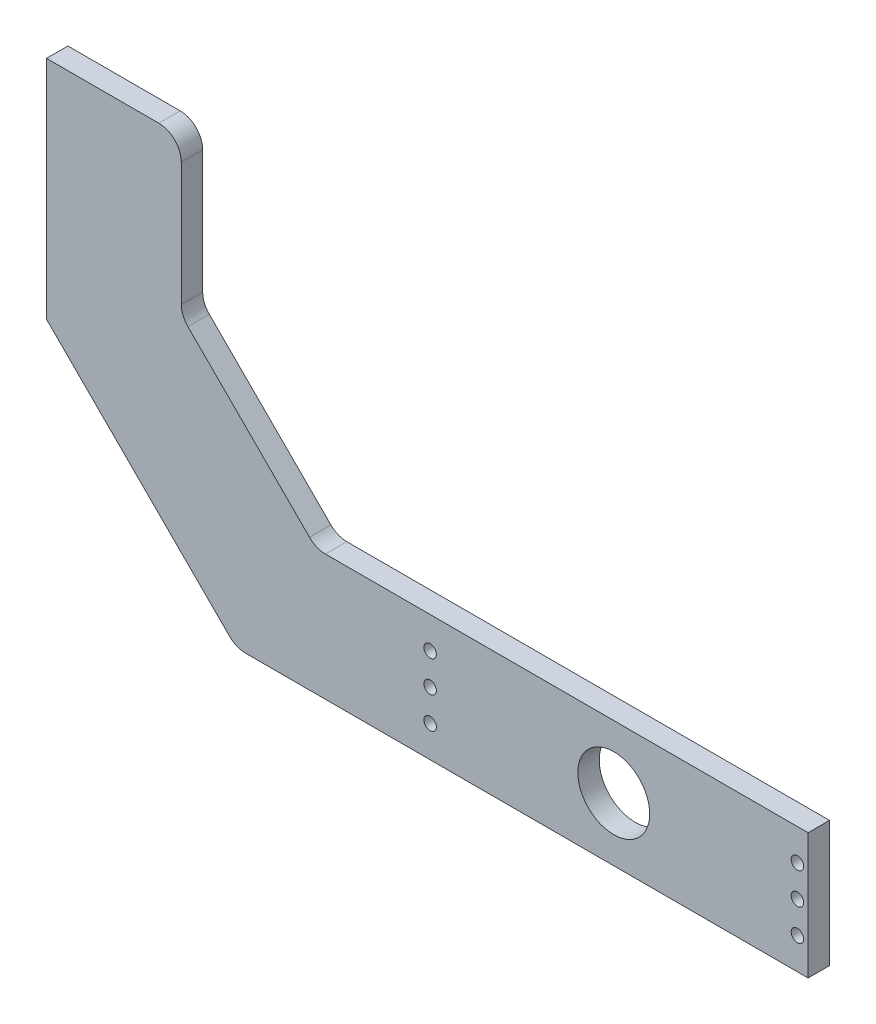
from build123d import *

# Parameters (mm, degrees)
RESSALTO_EXTRUS_O1_DEPTH = 9.525
ESBO_O3_R                = 16
CIRCULO_ROLAMENTO_DEPTH  = 10
ESBO_O6_R                = 2.5
CORTE_EXTRUS_O4_DEPTH    = 30
CORTE_EXTRUS_O6_DEPTH    = 10
ESBO_O10_R               = 2.78
CORTE_EXTRUS_O7_DEPTH    = 10
FILETE1_R                = 10
ESBO_O12_R               = 2.78
CORTE_EXTRUS_O8_DEPTH    = 10


with BuildPart() as part:
    # Esboço1 → Ressalto-extrusão1 (new body)
    with BuildSketch(Plane.XY):
        Polygon((-114.28595772, -92.023971813), (224.71404228, -92.023971813), (224.71404228, -36.023971813), (5.71404228, -36.023971813), (-54.28595772, 23.976028187), (-54.28595772, 92.976028187), (-114.28595772, 92.976028187), align=None)
    extrude(amount=RESSALTO_EXTRUS_O1_DEPTH)

    # Esboço3 → Circulo rolamento (cut)
    with BuildSketch(Plane.XY.offset(9.525)):
        with Locations((138.21404228, -64.023971813)):
            Circle(ESBO_O3_R)
    extrude(amount=-CIRCULO_ROLAMENTO_DEPTH, mode=Mode.SUBTRACT)

    # Esboço6 → Corte-extrusão4 (cut)
    with BuildSketch(Plane.ZY.offset(114.28595772)):
        with Locations(Location((4.7625, 67.976028187, 0), (0, 0, 270))):
            Circle(ESBO_O6_R)
        with Locations(Location((4.7625, 42.976028187, 0), (0, 0, 270))):
            Circle(ESBO_O6_R)
        with Locations(Location((4.7625, 17.976028187, 0), (0, 0, 270))):
            Circle(ESBO_O6_R)
    extrude(amount=-CORTE_EXTRUS_O4_DEPTH, mode=Mode.SUBTRACT)

    # Esboço9 → Corte-extrusão6 (cut)
    with BuildSketch(Plane.XY.offset(9.525)):
        Polygon((-29.841868762, -92.023971813), (-114.28595772, -7.579882856), (-114.28595772, -92.023971813), align=None)
    extrude(amount=-CORTE_EXTRUS_O6_DEPTH, mode=Mode.SUBTRACT)

    # Esboço10 → Corte-extrusão7 (cut)
    with BuildSketch(Plane.XY.offset(9.525)):
        with Locations((56.47404228, -50.023971813)):
            Circle(ESBO_O10_R)
        with Locations((56.47404228, -64.023971813)):
            Circle(ESBO_O10_R)
        with Locations((56.47404228, -78.023971813)):
            Circle(ESBO_O10_R)
    extrude(amount=-CORTE_EXTRUS_O7_DEPTH, mode=Mode.SUBTRACT)

    # Filete1
    filete1_edges = [part.edges().sort_by_distance(p)[0] for p in [
        (-54.28595772, 92.976028187, 4.7625),
        (-54.28595772, 23.976028187, 4.7625),
        (5.71404228, -36.023971813, 4.7625),
        (-29.841868762, -92.023971813, 4.7625),
    ]]
    fillet(filete1_edges, radius=FILETE1_R)

    # Esboço12 → Corte-extrusão8 (cut)
    with BuildSketch(Plane.XY.offset(9.525)):
        with Locations((219.95404228, -78.023971813)):
            Circle(ESBO_O12_R)
        with Locations((219.95404228, -64.023971813)):
            Circle(ESBO_O12_R)
        with Locations((219.95404228, -50.023971813)):
            Circle(ESBO_O12_R)
    extrude(amount=-CORTE_EXTRUS_O8_DEPTH, mode=Mode.SUBTRACT)


solid = part.part
